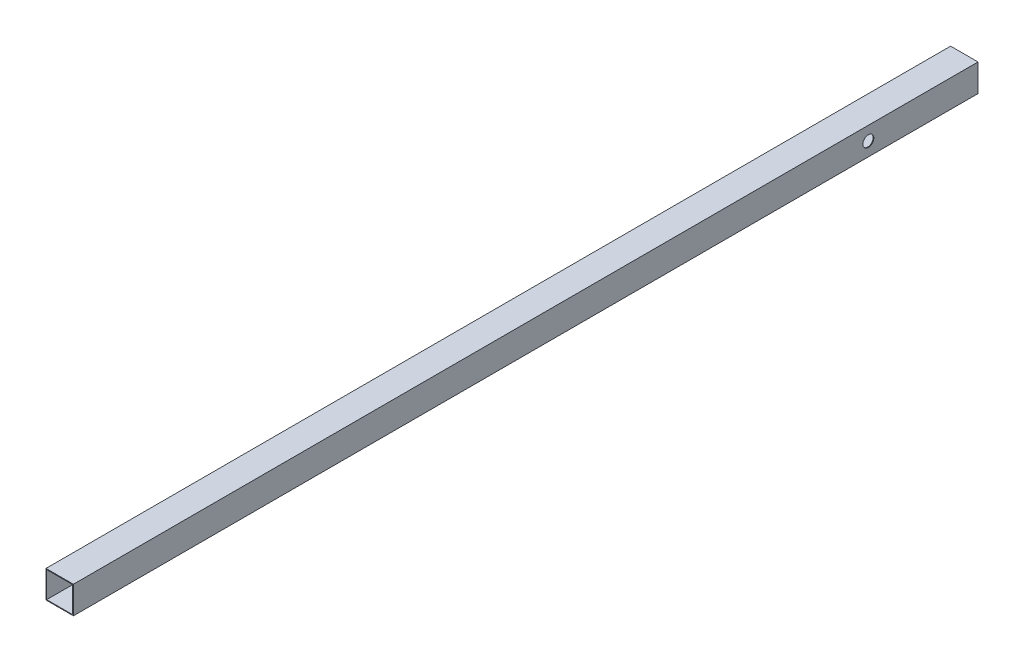
from build123d import *

# Parameters (mm, degrees)
SKETCH1_W           = 20
SKETCH1_H           = 20
BOSS_EXTRUDE1_DEPTH = 660
SKETCH2_W           = 19
SKETCH2_H           = 19
CUT_EXTRUDE1_DEPTH  = 660
SKETCH3_R           = 4
CUT_EXTRUDE2_DEPTH  = 20


with BuildPart() as part:
    # Sketch1 → Boss-Extrude1 (new body)
    with BuildSketch(Plane.XY):
        Rectangle(SKETCH1_W, SKETCH1_H)
    extrude(amount=BOSS_EXTRUDE1_DEPTH)

    # Sketch2 → Cut-Extrude1 (cut)
    with BuildSketch(Plane(origin=(0, 0, 0), x_dir=(-1, 0, 0), z_dir=(0, 0, -1))):
        Rectangle(SKETCH2_W, SKETCH2_H)
    extrude(amount=-CUT_EXTRUDE1_DEPTH, mode=Mode.SUBTRACT)

    # Sketch3 → Cut-Extrude2 (cut)
    with BuildSketch(Plane(origin=(10, 0, 0), x_dir=(0, 0, -1), z_dir=(1, 0, 0))):
        with Locations(Location((-80, 0, 0), (0, 0, 90))):
            Circle(SKETCH3_R)
    extrude(amount=-CUT_EXTRUDE2_DEPTH, mode=Mode.SUBTRACT)


solid = part.part
